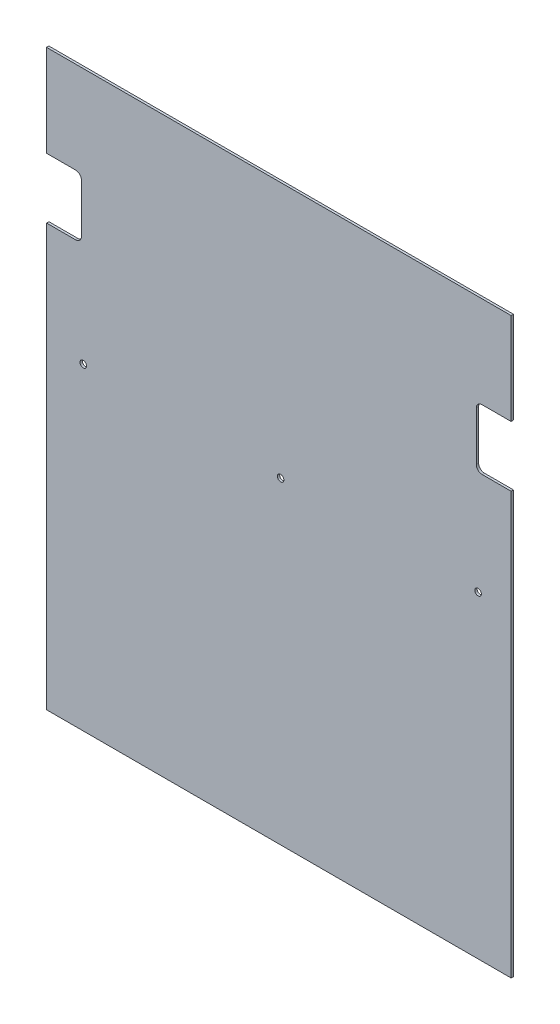
from build123d import *

# Parameters (mm, degrees)
SKETCH1_W           = 400
SKETCH1_H           = 494
BOSS_EXTRUDE1_DEPTH = 2
CUT_EXTRUDE3_DEPTH  = 10
FILLET1_R           = 5
SKETCH6_R           = 2.821572875
CUT_EXTRUDE4_DEPTH  = 60


with BuildPart() as part:
    # Sketch1 → Boss-Extrude1 (new body)
    with BuildSketch(Plane.XY):
        with Locations((0, -247)):
            Rectangle(SKETCH1_W, SKETCH1_H)
    extrude(amount=BOSS_EXTRUDE1_DEPTH)

    # Sketch5 → Cut-Extrude3 (cut)
    with BuildSketch(Plane.XY.offset(2)):
        Polygon((-200, -106), (-200, -79), (-170, -79), (-170, -106), (-170, -131), (-200, -131), align=None)
        Polygon((200, -131), (170, -131), (170, -106), (170, -79), (200, -79), (200, -106), align=None)
    extrude(amount=-CUT_EXTRUDE3_DEPTH, mode=Mode.SUBTRACT)

    # Fillet1
    fillet1_edges = [part.edges().sort_by_distance(p)[0] for p in [
        (-170, -79, 1),
        (-170, -131, 1),
        (170, -131, 1),
        (170, -79, 1),
    ]]
    fillet(fillet1_edges, radius=FILLET1_R)

    # Sketch6 → Cut-Extrude4 (cut)
    with BuildSketch(Plane(origin=(1.544513547, -237.458154074, 2), x_dir=(-1, 0, 0), z_dir=(0, 0, -1))):
        with Locations(Location((-170, 17, 0), (0, 0, 180))):
            Circle(SKETCH6_R)
        with Locations(Location((0, 17, 0), (0, 0, 180))):
            Circle(SKETCH6_R)
        with Locations(Location((170, 17, 0), (0, 0, 180))):
            Circle(SKETCH6_R)
    extrude(amount=CUT_EXTRUDE4_DEPTH, mode=Mode.SUBTRACT)


solid = part.part
